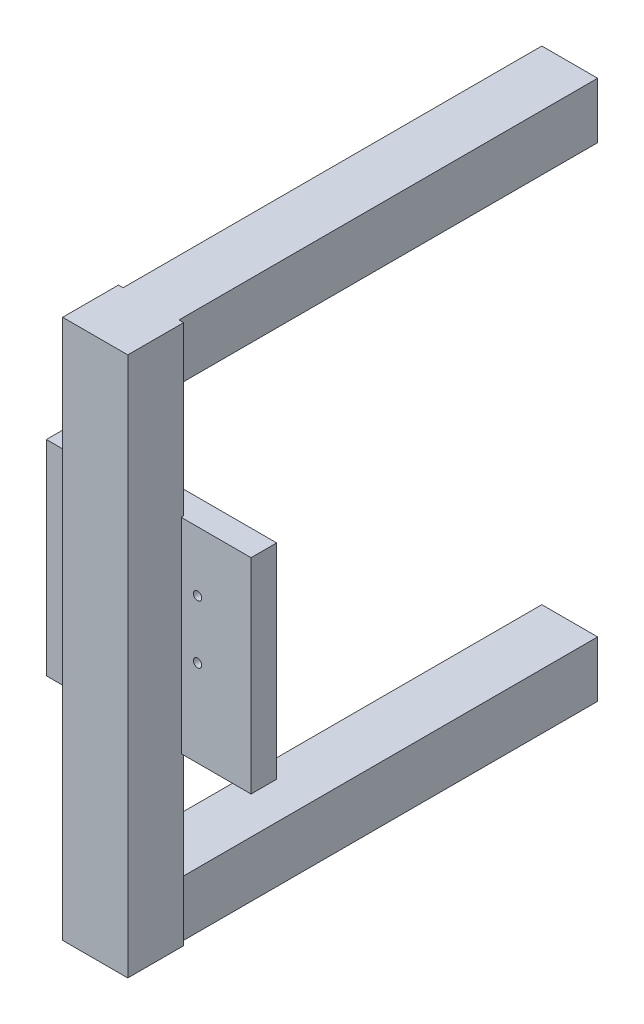
from build123d import *

# Parameters (mm, degrees)
CROSSBAR_START      = 133
SKETCH_1_W          = 14
SKETCH_1_H          = 116
CROSSBAR_DEPTH      = 12
POST_START          = 43
SKETCH_2_W          = 12
SKETCH_2_H          = 12
POST_DEPTH          = 102
EXTRUDE_START       = 43
SKETCH_3_W          = 12
SKETCH_3_H          = 12
EXTRUDE_3_DEPTH     = 102
CAMERAPLATE_START   = 128
SKETCH_4_W          = 44
SKETCH_4_H          = 44
CAMERAPLATE_DEPTH   = 5.5
CAMERARECESS_START  = 128
SKETCH_5_W          = 25.6
SKETCH_5_H          = 24.3
CAMERARECESS_DEPTH  = 1.6
LENSWINDOW_START    = 127
SKETCH_6_R          = 5
LENSWINDOW_DEPTH    = 7
CAMSCREW_START      = 127
SKETCH_7_R          = 0.9
CAMSCREW_DEPTH      = 7
CUT_EXTRUDE_START   = 127
SKETCH_8_R          = 0.9
CUT_EXTRUDE_4_DEPTH = 7
SKETCH_9_R          = 0.9
CUT_EXTRUDE_5_DEPTH = 7
SKETCH_10_R         = 0.9
CUT_EXTRUDE_6_DEPTH = 7


with BuildPart() as part:
    # 草图1 → Crossbar (new body)
    with BuildSketch(Plane.XY.offset(CROSSBAR_START)):
        with Locations((20, 0)):
            Rectangle(SKETCH_1_W, SKETCH_1_H)
    extrude(amount=CROSSBAR_DEPTH)

    # 草图2 → Post (add)
    with BuildSketch(Plane.XY.offset(POST_START)):
        with Locations((20, -52)):
            Rectangle(SKETCH_2_W, SKETCH_2_H)
    extrude(amount=POST_DEPTH)

    # 草图3 → 凸台-拉伸3 (add)
    with BuildSketch(Plane.XY.offset(EXTRUDE_START)):
        with Locations((20, 52)):
            Rectangle(SKETCH_3_W, SKETCH_3_H)
    extrude(amount=EXTRUDE_3_DEPTH)

    # 草图4 → CameraPlate (add)
    with BuildSketch(Plane.XY.offset(CAMERAPLATE_START)):
        with Locations((20, 0)):
            Rectangle(SKETCH_4_W, SKETCH_4_H)
    extrude(amount=CAMERAPLATE_DEPTH)

    # 草图5 → CameraRecess (cut)
    with BuildSketch(Plane.XY.offset(CAMERARECESS_START)):
        with Locations((20, 2.9)):
            Rectangle(SKETCH_5_W, SKETCH_5_H)
    extrude(amount=CAMERARECESS_DEPTH, mode=Mode.SUBTRACT)

    # 草图6 → LensWindow (cut)
    with BuildSketch(Plane.XY.offset(LENSWINDOW_START)):
        with Locations(Location((20, 0, 0), (0, 0, 180))):
            Circle(SKETCH_6_R)
    extrude(amount=LENSWINDOW_DEPTH, mode=Mode.SUBTRACT)

    # 草图7 → CamScrew (cut)
    with BuildSketch(Plane.XY.offset(CAMSCREW_START)):
        with Locations(Location((9.5, -3.35, 0), (0, 0, 180))):
            Circle(SKETCH_7_R)
    extrude(amount=CAMSCREW_DEPTH, mode=Mode.SUBTRACT)

    # 草图8 → 切除-拉伸4 (cut)
    with BuildSketch(Plane.XY.offset(CUT_EXTRUDE_START)):
        with Locations(Location((9.5, 9.15, 0), (0, 0, 180))):
            Circle(SKETCH_8_R)
    extrude(amount=CUT_EXTRUDE_4_DEPTH, mode=Mode.SUBTRACT)

    # 草图9 → 切除-拉伸5 (cut)
    with BuildSketch(Plane.XY.offset(CUT_EXTRUDE_START)):
        with Locations(Location((30.5, -3.35, 0), (0, 0, 180))):
            Circle(SKETCH_9_R)
    extrude(amount=CUT_EXTRUDE_5_DEPTH, mode=Mode.SUBTRACT)

    # 草图10 → 切除-拉伸6 (cut)
    with BuildSketch(Plane.XY.offset(CUT_EXTRUDE_START)):
        with Locations(Location((30.5, 9.15, 0), (0, 0, 180))):
            Circle(SKETCH_10_R)
    extrude(amount=CUT_EXTRUDE_6_DEPTH, mode=Mode.SUBTRACT)


solid = part.part
